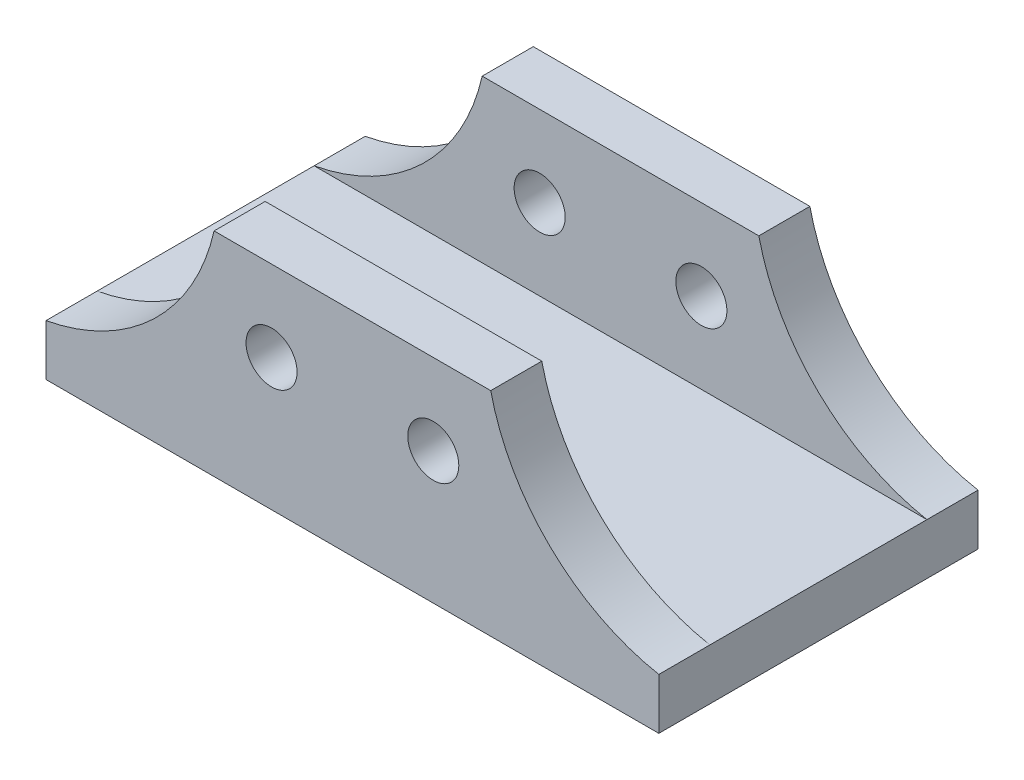
from build123d import *

# Parameters (mm, degrees)
SKETCH1_R           = 6
SKETCH1_W           = 72
SKETCH1_H           = 12
BOSS_EXTRUDE1_DEPTH = 37.5
SKETCH2_W           = 164.389356844
SKETCH2_H           = 51
CUT_EXTRUDE1_DEPTH  = 38
SKETCH3_R           = 5
CUT_EXTRUDE2_DEPTH  = 90.633977932


with BuildPart() as part:
    # Sketch1 → Boss-Extrude1 (new, symmetric)
    # profile 1 of 4: a face of its own
    with BuildSketch(Plane.XY):
        with BuildLine():
            ThreePointArc((-32.5, 12.5), (-46.579087682, -12.39476412), (-72, -25.5))
            Line((-72, -25.5), (0, -25.5))
            Line((0, -25.5), (0, 12.5))
            Line((0, 12.5), (-32.5, 12.5))
        make_face()
        with Locations((-19, -6.5)):
            Circle(SKETCH1_R, mode=Mode.SUBTRACT)
    # profile 2 of 4: a face of its own
    with BuildSketch(Plane.XY):
        with BuildLine():
            Line((0, 12.5), (0, -25.5))
            Line((0, -25.5), (72, -25.5))
            ThreePointArc((72, -25.5), (46.579087682, -12.39476412), (32.5, 12.5))
            Line((32.5, 12.5), (0, 12.5))
        make_face()
        with Locations((19, -6.5)):
            Circle(SKETCH1_R, mode=Mode.SUBTRACT)
    # profile 3 of 4: a face of its own
    with BuildSketch(Plane.XY):
        with Locations((-36, -31.5)):
            Rectangle(SKETCH1_W, SKETCH1_H)
    # profile 4 of 4: a face of its own
    with BuildSketch(Plane.XY):
        with Locations((36, -31.5)):
            Rectangle(SKETCH1_W, SKETCH1_H)
    extrude(amount=BOSS_EXTRUDE1_DEPTH, both=True)

    # Sketch2 → Cut-Extrude1 (cut)
    with BuildSketch(Plane(origin=(0, 12.5, 0), x_dir=(1, 0, 0), z_dir=(0, 1, 0))):
        Rectangle(SKETCH2_W, SKETCH2_H)
    extrude(amount=-CUT_EXTRUDE1_DEPTH, mode=Mode.SUBTRACT)

    # Sketch3 → Cut-Extrude2 (cut, through all)
    with BuildSketch(Plane(origin=(0, -25.5, 0), x_dir=(1, 0, 0), z_dir=(0, 1, 0))):
        with Locations(Location((0, 0, 0), (0, 0, 180))):
            Circle(SKETCH3_R)
    extrude(amount=-CUT_EXTRUDE2_DEPTH, mode=Mode.SUBTRACT)


solid = part.part
